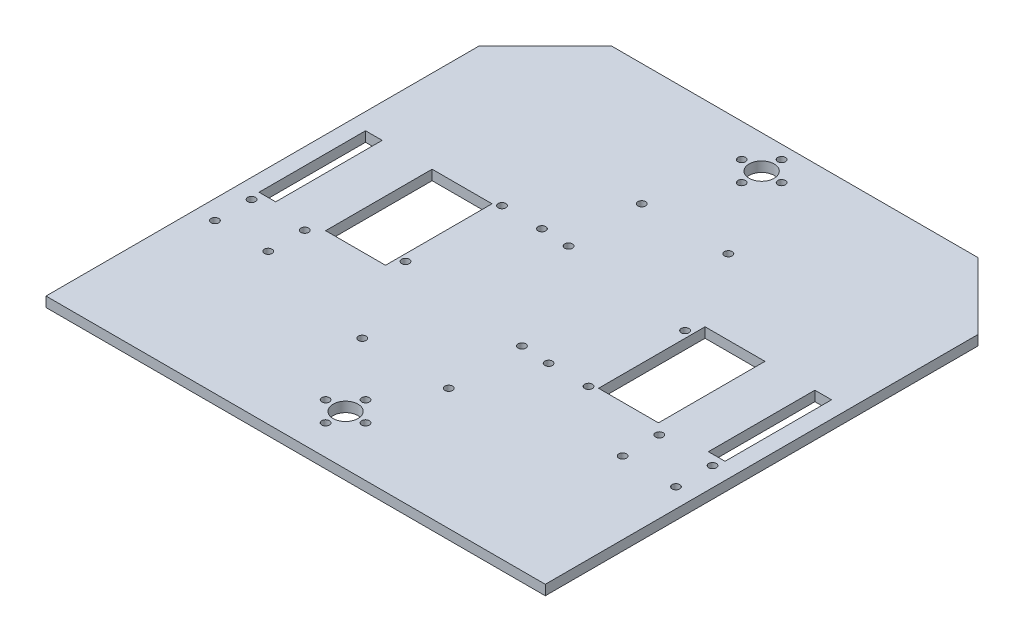
from build123d import *

# Parameters (mm, degrees)
ESQUISSE1_R              = 7.5
ESQUISSE1_R_2            = 2.3
BOSS_EXTRU_1_DEPTH       = 6
ESQUISSE7_W              = 10
ESQUISSE7_H              = 64
ENL_V_MAT_EXTRU_9_DEPTH  = 10.5
ESQUISSE6_R              = 2.3
ENL_V_MAT_EXTRU_10_DEPTH = 50
ENL_V_MAT_EXTRU_11_DEPTH = 50
ESQUISSE11_R             = 2.3
ENL_V_MAT_EXTRU_15_DEPTH = 10


with BuildPart() as part:
    # Esquisse1 → Boss.-Extru.1 (new body)
    with BuildSketch(Plane(origin=(0, 0, 0), x_dir=(1, 0, 0), z_dir=(0, 1, 0))):
        Polygon((-150, 0), (-150, 260), (-110, 300), (110, 300), (150, 260), (150, 0), align=None)
        with Locations(Location((0, 30, 0), (0, 0, 270))):
            Circle(ESQUISSE1_R, mode=Mode.SUBTRACT)
        with Locations(Location((0, 18, 0), (0, 0, 270))):
            Circle(ESQUISSE1_R_2, mode=Mode.SUBTRACT)
        with Locations(Location((12, 30, 0), (0, 0, 270))):
            Circle(ESQUISSE1_R_2, mode=Mode.SUBTRACT)
        with Locations(Location((0, 42, 0), (0, 0, 270))):
            Circle(ESQUISSE1_R_2, mode=Mode.SUBTRACT)
        with Locations(Location((-12, 30, 0), (0, 0, 270))):
            Circle(ESQUISSE1_R_2, mode=Mode.SUBTRACT)
        with Locations(Location((0, 280, 0), (0, 0, 270))):
            Circle(ESQUISSE1_R, mode=Mode.SUBTRACT)
        with Locations(Location((-12, 280, 0), (0, 0, 270))):
            Circle(ESQUISSE1_R_2, mode=Mode.SUBTRACT)
        with Locations(Location((0, 268, 0), (0, 0, 270))):
            Circle(ESQUISSE1_R_2, mode=Mode.SUBTRACT)
        with Locations(Location((12, 280, 0), (0, 0, 270))):
            Circle(ESQUISSE1_R_2, mode=Mode.SUBTRACT)
        with Locations(Location((0, 292, 0), (0, 0, 270))):
            Circle(ESQUISSE1_R_2, mode=Mode.SUBTRACT)
    extrude(amount=BOSS_EXTRU_1_DEPTH)

    # Esquisse7 → Enlèv. mat.-Extru.9 (cut)
    with BuildSketch(Plane(origin=(0, 6, 0), x_dir=(1, 0, 0), z_dir=(0, 1, 0))):
        with Locations((-135, 150)):
            Rectangle(ESQUISSE7_W, ESQUISSE7_H)
    enl_v_mat_extru_9 = extrude(amount=-ENL_V_MAT_EXTRU_9_DEPTH, mode=Mode.SUBTRACT)

    # Esquisse6 → Enlèv. mat.-Extru.10 (cut)
    with BuildSketch(Plane(origin=(0, 6, 0), x_dir=(1, 0, 0), z_dir=(0, 1, 0))):
        with Locations(Location((-138.5, 90, 0), (0, 0, 270))):
            Circle(ESQUISSE6_R)
        with Locations(Location((-138.5, 112, 0), (0, 0, 270))):
            Circle(ESQUISSE6_R)
        with Locations(Location((-106.5, 112, 0), (0, 0, 270))):
            Circle(ESQUISSE6_R)
        with Locations(Location((-106.5, 90, 0), (0, 0, 270))):
            Circle(ESQUISSE6_R)
    enl_v_mat_extru_10 = extrude(amount=-ENL_V_MAT_EXTRU_10_DEPTH, mode=Mode.SUBTRACT)

    # Esquisse4 → Enlèv. mat.-Extru.11 (cut)
    with BuildSketch(Plane(origin=(0, 6, 0), x_dir=(1, 0, 0), z_dir=(0, 1, 0))):
        Polygon((-100, 150), (-100, 182), (-64, 182), (-64, 118), (-100, 118), align=None)
    enl_v_mat_extru_11 = extrude(amount=-ENL_V_MAT_EXTRU_11_DEPTH, mode=Mode.SUBTRACT)

    # Symétrie1: Enlèv. mat.-Extru.9 across plane
    add(enl_v_mat_extru_9.mirror(Plane(origin=(0, 0, 0), x_dir=(0, 0, 1), z_dir=(1, 0, 0))), mode=Mode.SUBTRACT)

    # Symétrie2: Enlèv. mat.-Extru.11 across plane
    add(enl_v_mat_extru_11.mirror(Plane(origin=(0, 0, 0), x_dir=(0, 0, 1), z_dir=(1, 0, 0))), mode=Mode.SUBTRACT)

    # Symétrie3: Enlèv. mat.-Extru.10 across plane
    add(enl_v_mat_extru_10.mirror(Plane(origin=(0, 0, 0), x_dir=(0, 0, 1), z_dir=(1, 0, 0))), mode=Mode.SUBTRACT)

    # Esquisse11 → Enlèv. mat.-Extru.15 (cut)
    with BuildSketch(Plane(origin=(0, 6, 0), x_dir=(1, 0, 0), z_dir=(0, 1, 0))):
        with Locations(Location((36, 116, 0), (0, 0, 270))):
            Circle(ESQUISSE11_R)
        with Locations(Location((60, 116, 0), (0, 0, 270))):
            Circle(ESQUISSE11_R)
        with Locations(Location((60, 174, 0), (0, 0, 270))):
            Circle(ESQUISSE11_R)
        with Locations(Location((-19, 227, 0), (0, 0, 270))):
            Circle(ESQUISSE11_R)
        with Locations(Location((-19, 183, 0), (0, 0, 270))):
            Circle(ESQUISSE11_R)
        with Locations(Location((33, 227, 0), (0, 0, 270))):
            Circle(ESQUISSE11_R)
        with Locations(Location((19, 117, 0), (0, 0, 270))):
            Circle(ESQUISSE11_R)
        with Locations(Location((19, 73, 0), (0, 0, 270))):
            Circle(ESQUISSE11_R)
        with Locations(Location((-33, 73, 0), (0, 0, 270))):
            Circle(ESQUISSE11_R)
        with Locations(Location((-60, 126, 0), (0, 0, 270))):
            Circle(ESQUISSE11_R)
        with Locations(Location((-36, 184, 0), (0, 0, 270))):
            Circle(ESQUISSE11_R)
        with Locations(Location((-60, 184, 0), (0, 0, 270))):
            Circle(ESQUISSE11_R)
    extrude(amount=-ENL_V_MAT_EXTRU_15_DEPTH, mode=Mode.SUBTRACT)


solid = part.part
